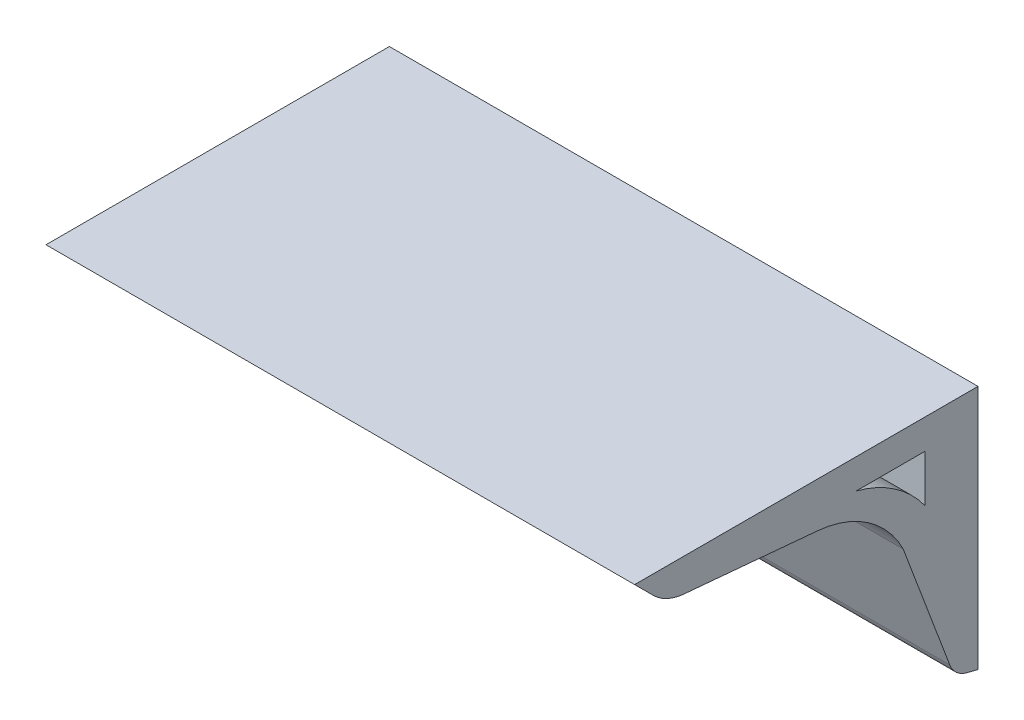
from build123d import *

# Parameters (mm, degrees)
CROQUIS1_W              = 120
CROQUIS1_H              = 50
SALIENTE_EXTRUIR1_DEPTH = 70
CORTAR_EXTRUIR1_DEPTH   = 121


with BuildPart() as part:
    # Croquis1 → Saliente-Extruir1 (new body)
    with BuildSketch(Plane.XY):
        with Locations((200.700947131, 43.628006873)):
            Rectangle(CROQUIS1_W, CROQUIS1_H)
    extrude(amount=SALIENTE_EXTRUIR1_DEPTH)

    # Croquis2 → Cortar-Extruir1 (cut)
    with BuildSketch(Plane(origin=(260.700947131, 0, 0), x_dir=(0, 0, -1), z_dir=(1, 0, 0))):
        with BuildLine():
            Line((-70, 68.628006873), (-66.203930164, 64.831937037))
            ThreePointArc((-66.203930164, 64.831937037), (-63.370887429, 62.845458633), (-60.030458687, 61.943370276))
            Line((-60.030458687, 61.943370276), (-32.714126266, 59.481528961))
            ThreePointArc((-32.714126266, 59.481528961), (-22.428502516, 55.786756469), (-15.255184219, 47.541218021))
            Line((-15.255184219, 47.541218021), (-5.740714687, 22.291279647))
            ThreePointArc((-5.740714687, 22.291279647), (-4.393024365, 20.325605767), (-2.288474759, 19.207118412))
            Line((-2.288474759, 19.207118412), (0, 18.628006873))
            Line((0, 18.628006873), (-70, 18.628006873))
            Line((-70, 18.628006873), (-70, 68.628006873))
        make_face()
        with BuildLine():
            Line((-10.777042467, 52.920195468), (-10.777042467, 62.571113796))
            Line((-10.777042467, 62.571113796), (-24.848704029, 62.571113796))
            ThreePointArc((-24.848704029, 62.571113796), (-16.959352467, 58.990142997), (-10.777042467, 52.920195468))
        make_face()
    extrude(amount=-CORTAR_EXTRUIR1_DEPTH, mode=Mode.SUBTRACT)


solid = part.part
